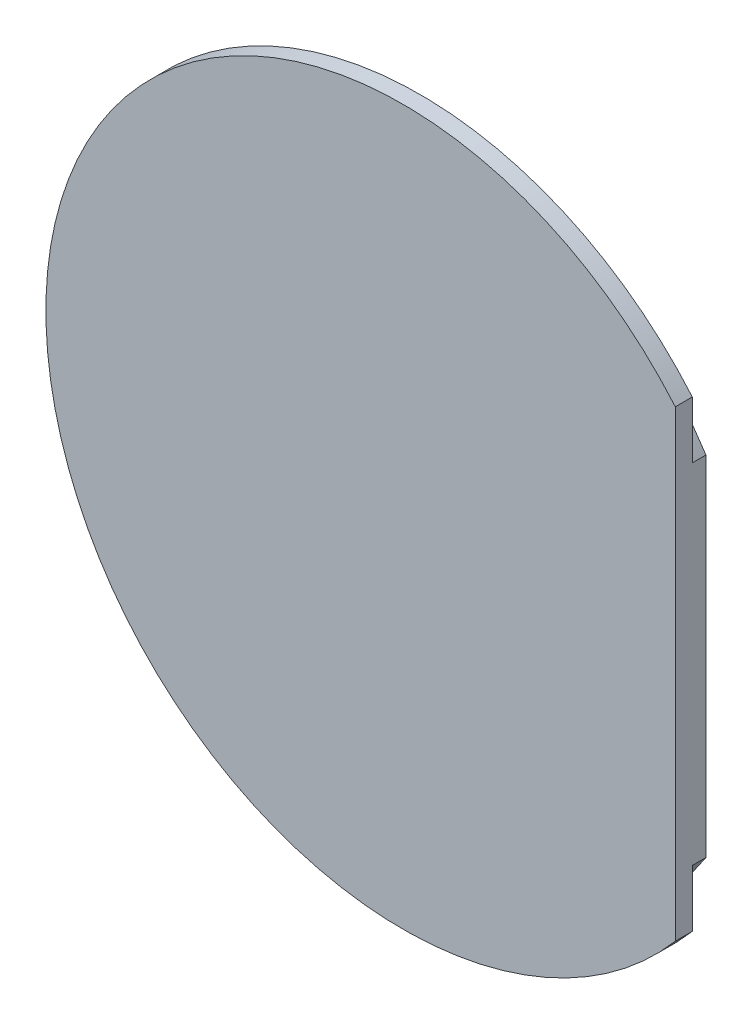
from build123d import *

# Parameters (mm, degrees)
BOSS_EXTRUDE1_START     = -27
SKETCH1_R               = 21
BOSS_EXTRUDE1_DEPTH     = 1
BOSS_EXTRUDE2_START     = -27.8
SKETCH2_R               = 19
BOSS_EXTRUDE2_DEPTH     = 0.8
CUT_EXTRUDE1_DEPTH      = 41.67972468
CUT_EXTRUDE1_DEPTH_BACK = 41.67972468
SKETCH3_W               = 14
SKETCH3_H               = 60


with BuildPart() as part:
    # Sketch1 → Boss-Extrude1 (new body)
    with BuildSketch(Plane.XY.offset(BOSS_EXTRUDE1_START)):
        Circle(SKETCH1_R)
    extrude(amount=BOSS_EXTRUDE1_DEPTH)

    # Sketch2 → Boss-Extrude2 (add)
    with BuildSketch(Plane.XY.offset(BOSS_EXTRUDE2_START)):
        Circle(SKETCH2_R)
    extrude(amount=BOSS_EXTRUDE2_DEPTH)

    # Sketch3 → Cut-Extrude1 (cut, two sides: drawn at the far end of the back side and taken through both)
    with BuildSketch(Plane.XY.offset(-CUT_EXTRUDE1_DEPTH_BACK)):
        with Locations((23, 0)):
            Rectangle(SKETCH3_W, SKETCH3_H)
    extrude(amount=CUT_EXTRUDE1_DEPTH + CUT_EXTRUDE1_DEPTH_BACK, mode=Mode.SUBTRACT)


solid = part.part
